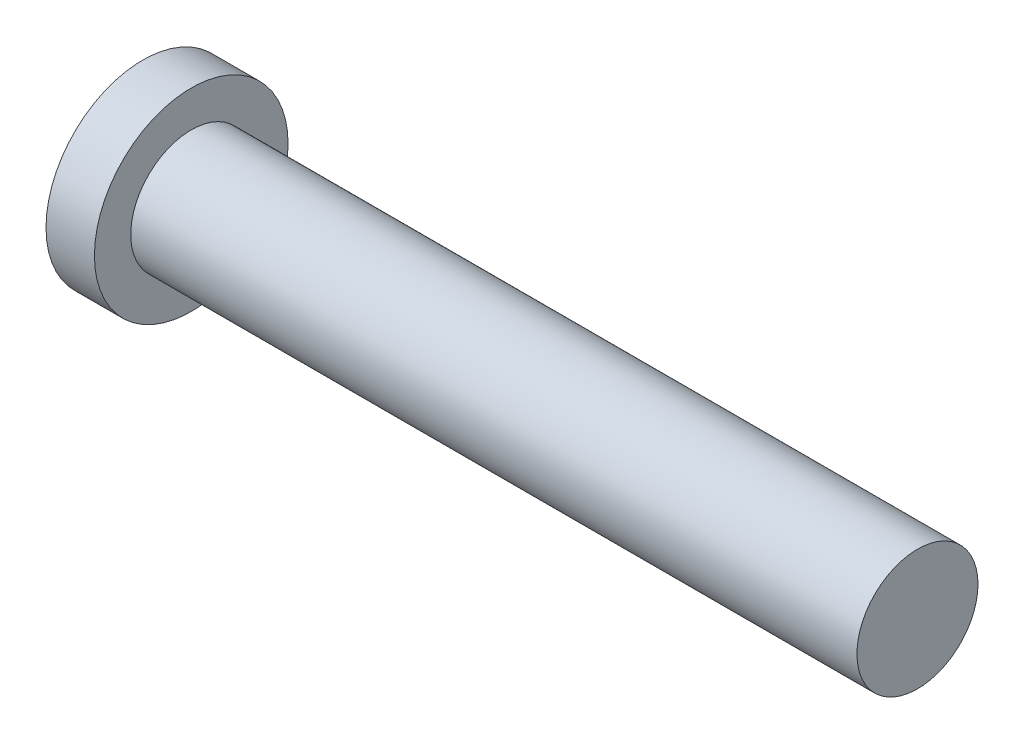
from build123d import *

# Parameters (mm, degrees)
SKETCH1_R           = 2.5
BOSS_EXTRUDE1_DEPTH = 30
SKETCH2_R           = 4
BOSS_EXTRUDE2_DEPTH = 2


with BuildPart() as part:
    # Sketch1 → Boss-Extrude1 (new body)
    with BuildSketch(Plane.YZ):
        with Locations(Location((0, 0, 0), (0, 0, 270))):
            Circle(SKETCH1_R)
    extrude(amount=BOSS_EXTRUDE1_DEPTH)

    # Sketch2 → Boss-Extrude2 (add)
    with BuildSketch(Plane(origin=(0, 0, 0), x_dir=(0, -1, 0), z_dir=(-1, 0, 0))):
        with Locations(Location((0, 0, 0), (0, 0, 90))):
            Circle(SKETCH2_R)
    extrude(amount=BOSS_EXTRUDE2_DEPTH)


solid = part.part
